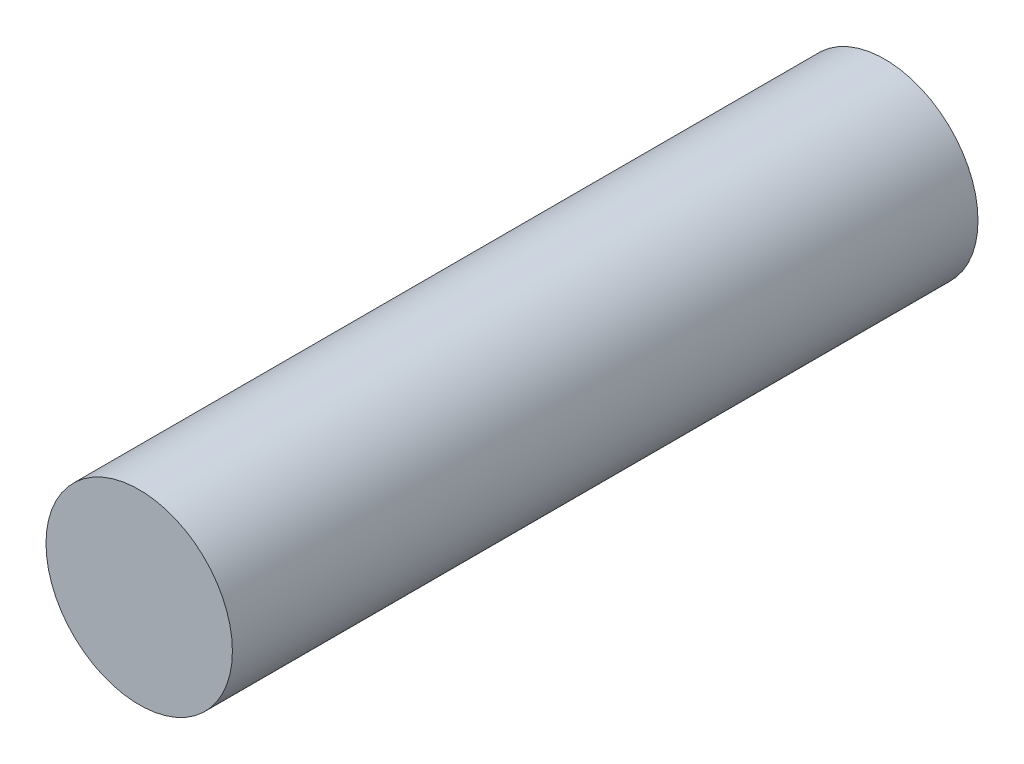
from build123d import *

# Parameters (mm, degrees)
SKETCH1_R          = 9.525
BASE_EXTRUDE_DEPTH = 76.2


with BuildPart() as part:
    # Sketch1 → Base-Extrude (new body)
    with BuildSketch(Plane.XY):
        with Locations(Location((0, 0, 0), (0, 0, 180))):
            Circle(SKETCH1_R)
    extrude(amount=BASE_EXTRUDE_DEPTH)


solid = part.part
